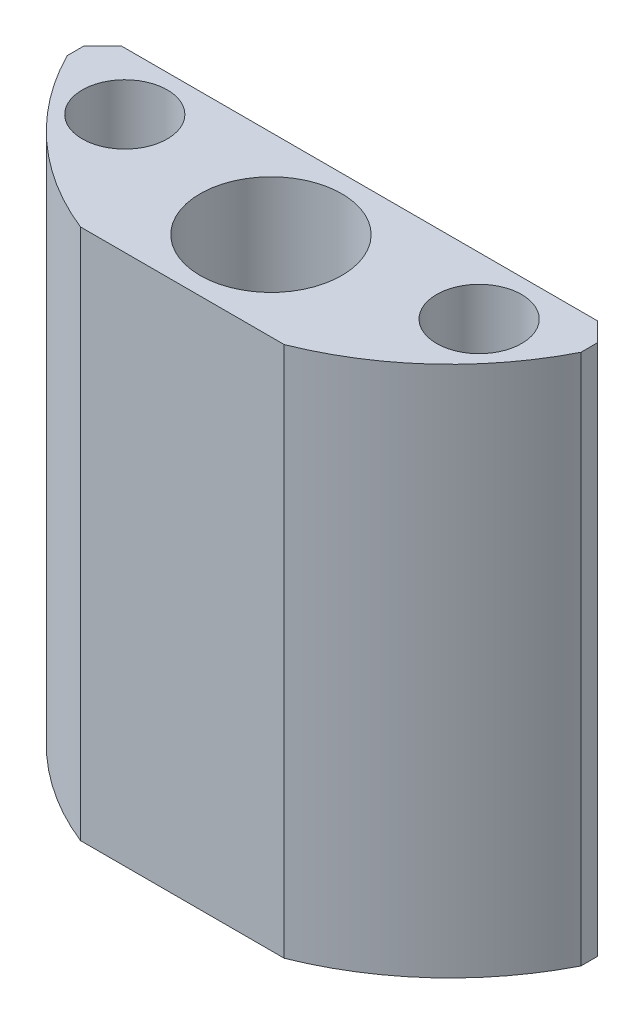
from build123d import *

# Parameters (mm, degrees)
BOSS_EXTRUDE1_DEPTH = 60
SKETCH2_R           = 4
SKETCH2_R_2         = 8
CUT_EXTRUDE1_DEPTH  = 70.577295147
SKETCH3_R           = 4.8
CUT_EXTRUDE2_DEPTH  = 48


with BuildPart() as part:
    # Sketch1 → Boss-Extrude1 (new body)
    with BuildSketch(Plane(origin=(0, 0, 0), x_dir=(1, 0, 0), z_dir=(0, 1, 0))):
        with BuildLine():
            Line((-26.878679656, 0), (26.878679656, 0))
            Line((26.878679656, 0), (29, -2.121320344))
            Line((29, -2.121320344), (29, -4))
            ThreePointArc((29, -4), (21.712972029, -13.600125657), (11.5, -20))
            Line((11.5, -20), (-11.5, -20))
            ThreePointArc((-11.5, -20), (-21.712972029, -13.600125657), (-29, -4))
            Line((-29, -4), (-29, -2.121320344))
            Line((-29, -2.121320344), (-26.878679656, 0))
        make_face()
    extrude(amount=-BOSS_EXTRUDE1_DEPTH)

    # Sketch2 → Cut-Extrude1 (cut, through all)
    with BuildSketch(Plane(origin=(0, 0, 0), x_dir=(1, 0, 0), z_dir=(0, 1, 0))):
        with Locations(Location((-20, -6.5, 0), (0, 0, 270))):
            Circle(SKETCH2_R)
        with Locations(Location((0, -10, 0), (0, 0, 270))):
            Circle(SKETCH2_R_2)
        with Locations(Location((20, -6.5, 0), (0, 0, 270))):
            Circle(SKETCH2_R)
    extrude(amount=-CUT_EXTRUDE1_DEPTH, mode=Mode.SUBTRACT)

    # Sketch3 → Cut-Extrude2 (cut)
    with BuildSketch(Plane(origin=(0, 0, 0), x_dir=(1, 0, 0), z_dir=(0, 1, 0))):
        with Locations(Location((-20, -6.5, 0), (0, 0, 270))):
            Circle(SKETCH3_R)
        with Locations(Location((20, -6.5, 0), (0, 0, 270))):
            Circle(SKETCH3_R)
    extrude(amount=-CUT_EXTRUDE2_DEPTH, mode=Mode.SUBTRACT)


solid = part.part
